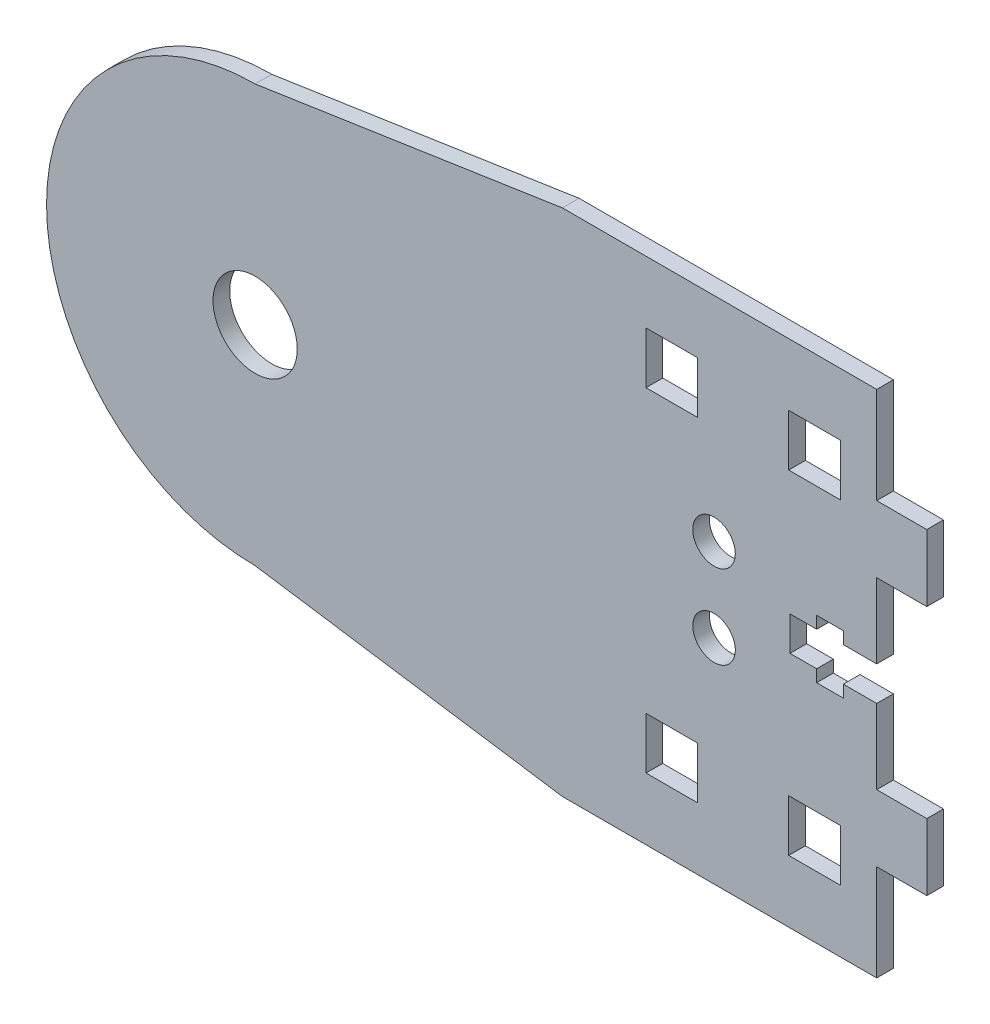
from build123d import *

# Parameters (mm, degrees)
SKETCH_1_R      = 5.05
SKETCH_1_R_2    = 2.55
SKETCH_1_W      = 6.2
SKETCH_1_H      = 6.2
EXTRUDE_1_DEPTH = 2


with BuildPart() as part:
    # 草图1 → 凸台-拉伸1 (new body)
    with BuildSketch(Plane.XY):
        with BuildLine():
            Line((0, -25), (36.822908512, -30.548036369))
            Line((36.822908512, -30.548036369), (74.5, -30.548036369))
            Line((74.5, -30.548036369), (74.5, -19))
            Line((74.5, -19), (80.5, -19))
            Line((80.5, -19), (80.5, -11))
            Line((80.5, -11), (74.5, -11))
            Line((74.5, -11), (74.5, -2.05))
            Line((74.5, -2.05), (70.5, -2.05))
            Line((70.5, -2.05), (70.5, -3.5))
            Line((70.5, -3.5), (67.3, -3.5))
            Line((67.3, -3.5), (67.3, -2.05))
            Line((67.3, -2.05), (64.1, -2.05))
            Line((64.1, -2.05), (64.1, 2.05))
            Line((64.1, 2.05), (67.3, 2.05))
            Line((67.3, 2.05), (67.3, 3.5))
            Line((67.3, 3.5), (70.5, 3.5))
            Line((70.5, 3.5), (70.5, 2.05))
            Line((70.5, 2.05), (74.5, 2.05))
            Line((74.5, 2.05), (74.5, 11))
            Line((74.5, 11), (80.5, 11))
            Line((80.5, 11), (80.5, 19))
            Line((80.5, 19), (74.5, 19))
            Line((74.5, 19), (74.5, 30.548036369))
            Line((74.5, 30.548036369), (36.822908512, 30.548036369))
            Line((36.822908512, 30.548036369), (0, 25))
            ThreePointArc((0, 25), (-25, 0), (0, -25))
        make_face()
        Circle(SKETCH_1_R, mode=Mode.SUBTRACT)
        with Locations((55, 5)):
            Circle(SKETCH_1_R_2, mode=Mode.SUBTRACT)
        with Locations(Location((55, -5, 0), (0, 0, 180))):
            Circle(SKETCH_1_R_2, mode=Mode.SUBTRACT)
        with Locations((67.05, -20)):
            Rectangle(SKETCH_1_W, SKETCH_1_H, mode=Mode.SUBTRACT)
        with Locations((49.95, -20)):
            Rectangle(SKETCH_1_W, SKETCH_1_H, mode=Mode.SUBTRACT)
        with Locations((49.95, 20)):
            Rectangle(SKETCH_1_W, SKETCH_1_H, mode=Mode.SUBTRACT)
        with Locations((67.05, 20)):
            Rectangle(SKETCH_1_W, SKETCH_1_H, mode=Mode.SUBTRACT)
    extrude(amount=EXTRUDE_1_DEPTH)


solid = part.part
